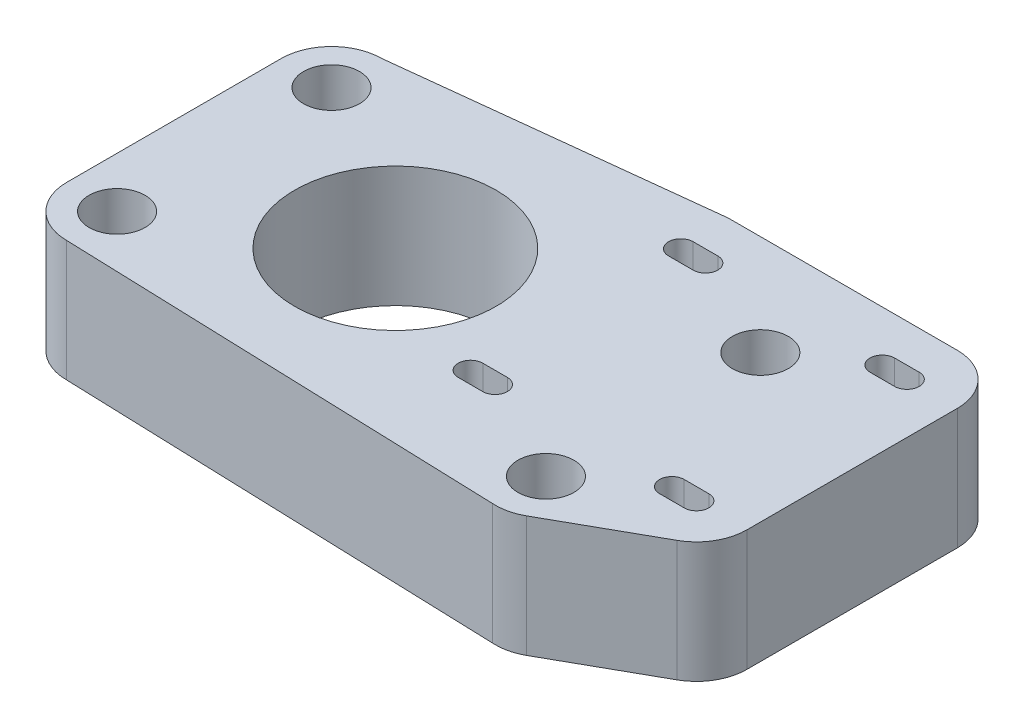
from build123d import *

# Parameters (mm, degrees)
SKETCH1_W           = 150.5
SKETCH1_H           = 110.25
SKETCH1_R           = 2.5
BOSS_EXTRUDE1_DEPTH = 27
SKETCH3_W           = 300
SKETCH3_H           = 200
SKETCH3_W_2         = 150.5
SKETCH3_H_2         = 110.25
BOSS_EXTRUDE2_DEPTH = 27
SKETCH4_R           = 6.25
CUT_EXTRUDE2_DEPTH  = 9
SKETCH5_R           = 2.75
CUT_EXTRUDE3_DEPTH  = 183.288233301
CUT_EXTRUDE4_START  = -9
CUT_EXTRUDE4_DEPTH  = 9
SKETCH7_W           = 300
SKETCH7_H           = 200
SKETCH7_R           = 22.5
CUT_EXTRUDE5_DEPTH  = 183.288233301


with BuildPart() as part:
    # Sketch1 → Boss-Extrude1 (new body)
    with BuildSketch(Plane(origin=(0, 0, 0), x_dir=(1, 0, 0), z_dir=(0, 1, 0))):
        Rectangle(SKETCH1_W, SKETCH1_H)
        with Locations(Location((-48.4, -42.875, 0), (0, 0, 270))):
            Circle(SKETCH1_R, mode=Mode.SUBTRACT)
        with Locations(Location((50.75, -46.225, 0), (0, 0, 270))):
            Circle(SKETCH1_R, mode=Mode.SUBTRACT)
        with Locations(Location((-48.4, 5.025, 0), (0, 0, 270))):
            Circle(SKETCH1_R, mode=Mode.SUBTRACT)
        with Locations(Location((50.75, 1.675, 0), (0, 0, 270))):
            Circle(SKETCH1_R, mode=Mode.SUBTRACT)
    extrude(amount=BOSS_EXTRUDE1_DEPTH)

    # Sketch3 → Boss-Extrude2 (add)
    with BuildSketch(Plane(origin=(0, 0, 0), x_dir=(1, 0, 0), z_dir=(0, 1, 0))):
        Rectangle(SKETCH3_W, SKETCH3_H)
        Rectangle(SKETCH3_W_2, SKETCH3_H_2, mode=Mode.SUBTRACT)
    extrude(amount=BOSS_EXTRUDE2_DEPTH)

    # Sketch4 → Cut-Extrude2 (cut)
    with BuildSketch(Plane(origin=(0, 27, 0), x_dir=(1, 0, 0), z_dir=(0, 1, 0))):
        with Locations(Location((-48.4, 5.025, 0), (0, 0, 270))):
            Circle(SKETCH4_R)
        with Locations(Location((-48.4, -42.875, 0), (0, 0, 270))):
            Circle(SKETCH4_R)
        with Locations(Location((50.75, -46.225, 0), (0, 0, 270))):
            Circle(SKETCH4_R)
        with Locations(Location((50.75, 1.675, 0), (0, 0, 270))):
            Circle(SKETCH4_R)
    extrude(amount=-CUT_EXTRUDE2_DEPTH, mode=Mode.SUBTRACT)

    # Sketch5 → Cut-Extrude3 (cut, through all)
    with BuildSketch(Plane(origin=(0, 27, 0), x_dir=(1, 0, 0), z_dir=(0, 1, 0))):
        with Locations((21.807305742, 12.85873859)):
            Circle(SKETCH5_R)
        with Locations((24.557305742, 12.85873859)):
            Circle(SKETCH5_R)
        with Locations((27.307305742, 12.85873859)):
            Circle(SKETCH5_R)
        with BuildLine():
            Line((27.307305742, 15.60873859), (24.557305742, 15.60873859))
            ThreePointArc((24.557305742, 15.60873859), (25.269058116, 15.515034613), (25.932305742, 15.240308451))
            ThreePointArc((25.932305742, 15.240308451), (26.595553368, 15.515034613), (27.307305742, 15.60873859))
        make_face()
        with BuildLine():
            Line((24.557305742, 15.60873859), (21.807305742, 15.60873859))
            ThreePointArc((21.807305742, 15.60873859), (22.519058116, 15.515034613), (23.182305742, 15.240308451))
            ThreePointArc((23.182305742, 15.240308451), (23.845553368, 15.515034613), (24.557305742, 15.60873859))
        make_face()
        with BuildLine():
            ThreePointArc((23.182305742, 10.47716873), (22.519058116, 10.202442568), (21.807305742, 10.10873859))
            Line((21.807305742, 10.10873859), (24.557305742, 10.10873859))
            ThreePointArc((24.557305742, 10.10873859), (23.845553368, 10.202442568), (23.182305742, 10.47716873))
        make_face()
        with BuildLine():
            ThreePointArc((25.932305742, 10.47716873), (25.269058116, 10.202442568), (24.557305742, 10.10873859))
            Line((24.557305742, 10.10873859), (27.307305742, 10.10873859))
            ThreePointArc((27.307305742, 10.10873859), (26.595553368, 10.202442568), (25.932305742, 10.47716873))
        make_face()
        with Locations((69.557305742, 12.85873859)):
            Circle(SKETCH5_R)
        with Locations((66.807305742, 12.85873859)):
            Circle(SKETCH5_R)
        with Locations((72.307305742, 12.85873859)):
            Circle(SKETCH5_R)
        with BuildLine():
            Line((69.557305742, 15.60873859), (66.807305742, 15.60873859))
            ThreePointArc((66.807305742, 15.60873859), (67.519058116, 15.515034613), (68.182305742, 15.240308451))
            ThreePointArc((68.182305742, 15.240308451), (68.845553368, 15.515034613), (69.557305742, 15.60873859))
        make_face()
        with BuildLine():
            ThreePointArc((70.932305742, 15.240308451), (71.595553368, 15.515034613), (72.307305742, 15.60873859))
            Line((72.307305742, 15.60873859), (69.557305742, 15.60873859))
            ThreePointArc((69.557305742, 15.60873859), (70.269058116, 15.515034613), (70.932305742, 15.240308451))
        make_face()
        with BuildLine():
            Line((66.807305742, 10.10873859), (69.557305742, 10.10873859))
            ThreePointArc((69.557305742, 10.10873859), (68.845553368, 10.202442568), (68.182305742, 10.47716873))
            ThreePointArc((68.182305742, 10.47716873), (67.519058116, 10.202442568), (66.807305742, 10.10873859))
        make_face()
        with BuildLine():
            Line((69.557305742, 10.10873859), (72.307305742, 10.10873859))
            ThreePointArc((72.307305742, 10.10873859), (71.595553368, 10.202442568), (70.932305742, 10.47716873))
            ThreePointArc((70.932305742, 10.47716873), (70.269058116, 10.202442568), (69.557305742, 10.10873859))
        make_face()
        with Locations((66.807305742, -34.14126141)):
            Circle(SKETCH5_R)
        with Locations((69.557305742, -34.14126141)):
            Circle(SKETCH5_R)
        with Locations((72.307305742, -34.14126141)):
            Circle(SKETCH5_R)
        with BuildLine():
            ThreePointArc((70.932305742, -31.759691549), (71.595553368, -31.484965387), (72.307305742, -31.39126141))
            Line((72.307305742, -31.39126141), (69.557305742, -31.39126141))
            ThreePointArc((69.557305742, -31.39126141), (70.269058116, -31.484965387), (70.932305742, -31.759691549))
        make_face()
        with BuildLine():
            Line((69.557305742, -31.39126141), (66.807305742, -31.39126141))
            ThreePointArc((66.807305742, -31.39126141), (67.519058116, -31.484965387), (68.182305742, -31.759691549))
            ThreePointArc((68.182305742, -31.759691549), (68.845553368, -31.484965387), (69.557305742, -31.39126141))
        make_face()
        with BuildLine():
            Line((69.557305801, -36.89126141), (72.307305742, -36.89126141))
            ThreePointArc((72.307305742, -36.89126141), (71.595553368, -36.797557432), (70.932305742, -36.52283127))
            ThreePointArc((70.932305742, -36.52283127), (70.269058145, -36.797557424), (69.557305801, -36.89126141))
        make_face()
        with BuildLine():
            Line((66.807305742, -36.89126141), (69.557305801, -36.89126141))
            ThreePointArc((69.557305801, -36.89126141), (68.845553397, -36.79755744), (68.182305742, -36.52283127))
            ThreePointArc((68.182305742, -36.52283127), (67.519058116, -36.797557432), (66.807305742, -36.89126141))
        make_face()
        with Locations((21.807305742, -34.14126141)):
            Circle(SKETCH5_R)
        with Locations((24.557305742, -34.14126141)):
            Circle(SKETCH5_R)
        with Locations((27.307305742, -34.14126141)):
            Circle(SKETCH5_R)
        with BuildLine():
            Line((24.557305824, -31.39126141), (21.807305742, -31.39126141))
            ThreePointArc((21.807305742, -31.39126141), (22.519058116, -31.484965387), (23.182305742, -31.759691549))
            ThreePointArc((23.182305742, -31.759691549), (23.845553407, -31.484965377), (24.557305824, -31.39126141))
        make_face()
        with BuildLine():
            Line((27.307305742, -31.39126141), (24.557305824, -31.39126141))
            ThreePointArc((24.557305824, -31.39126141), (25.269058156, -31.484965398), (25.932305742, -31.759691549))
            ThreePointArc((25.932305742, -31.759691549), (26.595553368, -31.484965387), (27.307305742, -31.39126141))
        make_face()
        with BuildLine():
            ThreePointArc((25.932305742, -36.52283127), (25.269058116, -36.797557432), (24.557305742, -36.89126141))
            Line((24.557305742, -36.89126141), (27.307305742, -36.89126141))
            ThreePointArc((27.307305742, -36.89126141), (26.595553368, -36.797557432), (25.932305742, -36.52283127))
        make_face()
        with BuildLine():
            ThreePointArc((23.182305742, -36.52283127), (22.519058116, -36.797557432), (21.807305742, -36.89126141))
            Line((21.807305742, -36.89126141), (24.557305742, -36.89126141))
            ThreePointArc((24.557305742, -36.89126141), (23.845553368, -36.797557432), (23.182305742, -36.52283127))
        make_face()
    extrude(amount=-CUT_EXTRUDE3_DEPTH, mode=Mode.SUBTRACT)

    # Sketch6 → Cut-Extrude4 (cut)
    # profile 1 of 4: a face of its own
    with BuildSketch(Plane.XZ.offset(CUT_EXTRUDE4_START)):
        with BuildLine():
            ThreePointArc((21.807305742, 40.39126141), (15.557305742, 34.14126141), (21.807305742, 27.89126141))
            Line((21.807305742, 27.89126141), (27.307305742, 27.89126141))
            ThreePointArc((27.307305742, 27.89126141), (33.557305742, 34.14126141), (27.307305742, 40.39126141))
            Line((27.307305742, 40.39126141), (21.807305742, 40.39126141))
        make_face()
        with BuildLine():
            Line((21.807305742, 36.89126141), (27.307305742, 36.89126141))
            ThreePointArc((27.307305742, 36.89126141), (30.057305742, 34.14126141), (27.307305742, 31.39126141))
            Line((27.307305742, 31.39126141), (21.807305742, 31.39126141))
            ThreePointArc((21.807305742, 31.39126141), (19.057305742, 34.14126141), (21.807305742, 36.89126141))
        make_face(mode=Mode.SUBTRACT)
    # profile 2 of 4: a face of its own
    with BuildSketch(Plane.XZ.offset(CUT_EXTRUDE4_START)):
        with BuildLine():
            ThreePointArc((72.307305742, 27.89126141), (78.557305742, 34.14126141), (72.307305742, 40.39126141))
            Line((72.307305742, 40.39126141), (66.807305742, 40.39126141))
            ThreePointArc((66.807305742, 40.39126141), (60.557305742, 34.14126141), (66.807305742, 27.89126141))
            Line((66.807305742, 27.89126141), (72.307305742, 27.89126141))
        make_face()
        with BuildLine():
            Line((72.307305742, 31.39126141), (66.807305742, 31.39126141))
            ThreePointArc((66.807305742, 31.39126141), (64.057305742, 34.14126141), (66.807305742, 36.89126141))
            Line((66.807305742, 36.89126141), (72.307305742, 36.89126141))
            ThreePointArc((72.307305742, 36.89126141), (75.057305742, 34.14126141), (72.307305742, 31.39126141))
        make_face(mode=Mode.SUBTRACT)
    # profile 3 of 4: a face of its own
    with BuildSketch(Plane.XZ.offset(CUT_EXTRUDE4_START)):
        with BuildLine():
            ThreePointArc((72.307305742, -19.10873859), (78.557305742, -12.85873859), (72.307305742, -6.60873859))
            Line((72.307305742, -6.60873859), (66.807305742, -6.60873859))
            ThreePointArc((66.807305742, -6.60873859), (60.557305742, -12.85873859), (66.807305742, -19.10873859))
            Line((66.807305742, -19.10873859), (72.307305742, -19.10873859))
        make_face()
        with BuildLine():
            Line((72.307305742, -15.60873859), (66.807305742, -15.60873859))
            ThreePointArc((66.807305742, -15.60873859), (64.057305742, -12.85873859), (66.807305742, -10.10873859))
            Line((66.807305742, -10.10873859), (72.307305742, -10.10873859))
            ThreePointArc((72.307305742, -10.10873859), (75.057305742, -12.85873859), (72.307305742, -15.60873859))
        make_face(mode=Mode.SUBTRACT)
    # profile 4 of 4: a face of its own
    with BuildSketch(Plane.XZ.offset(CUT_EXTRUDE4_START)):
        with BuildLine():
            ThreePointArc((21.807305742, -6.60873859), (15.557305742, -12.85873859), (21.807305742, -19.10873859))
            Line((21.807305742, -19.10873859), (27.307305742, -19.10873859))
            ThreePointArc((27.307305742, -19.10873859), (33.557305742, -12.85873859), (27.307305742, -6.60873859))
            Line((27.307305742, -6.60873859), (21.807305742, -6.60873859))
        make_face()
        with BuildLine():
            Line((21.807305742, -10.10873859), (27.307305742, -10.10873859))
            ThreePointArc((27.307305742, -10.10873859), (30.057305742, -12.85873859), (27.307305742, -15.60873859))
            Line((27.307305742, -15.60873859), (21.807305742, -15.60873859))
            ThreePointArc((21.807305742, -15.60873859), (19.057305742, -12.85873859), (21.807305742, -10.10873859))
        make_face(mode=Mode.SUBTRACT)
    extrude(amount=CUT_EXTRUDE4_DEPTH, mode=Mode.SUBTRACT)

    # Sketch7 → Cut-Extrude5 (cut, through all)
    # profile 1 of 2: a face of its own
    with BuildSketch(Plane(origin=(0, 0, 0), x_dir=(1, 0, 0), z_dir=(0, 1, 0))):
        Rectangle(SKETCH7_W, SKETCH7_H)
        with BuildLine():
            Line((-59.65, -42.875), (-59.65, 5.025))
            ThreePointArc((-59.65, 5.025), (-56.354951288, 12.979951288), (-48.4, 16.275))
            Line((-48.4, 16.275), (20.548592348, 24.038100853))
            ThreePointArc((20.548592348, 24.038100853), (21.176958794, 24.091065274), (21.807305742, 24.10873859))
            Line((21.807305742, 24.10873859), (72.307305742, 24.10873859))
            ThreePointArc((72.307305742, 24.10873859), (80.26225703, 20.813689879), (83.557305742, 12.85873859))
            Line((83.557305742, 12.85873859), (83.557305742, -34.14126141))
            ThreePointArc((83.557305742, -34.14126141), (82.014178767, -39.828010575), (77.808129551, -43.95469289))
            Line((77.808129551, -43.95469289), (56.250823809, -56.03843148))
            ThreePointArc((56.250823809, -56.03843148), (53.592656842, -57.109934638), (50.75, -57.475))
            ThreePointArc((50.75, -57.475), (50.370110874, -57.468584137), (49.990655048, -57.449343867))
            Line((49.990655048, -57.449343867), (-48.4, -54.125))
            ThreePointArc((-48.4, -54.125), (-56.354951288, -50.829951288), (-59.65, -42.875))
        make_face(mode=Mode.SUBTRACT)
    # profile 2 of 2: a face of its own
    with BuildSketch(Plane(origin=(0, 0, 0), x_dir=(1, 0, 0), z_dir=(0, 1, 0))):
        with Locations(Location((-10.18695891, -18.925, 0), (0, 0, 270))):
            Circle(SKETCH7_R)
    extrude(amount=CUT_EXTRUDE5_DEPTH, mode=Mode.SUBTRACT)


solid = part.part
